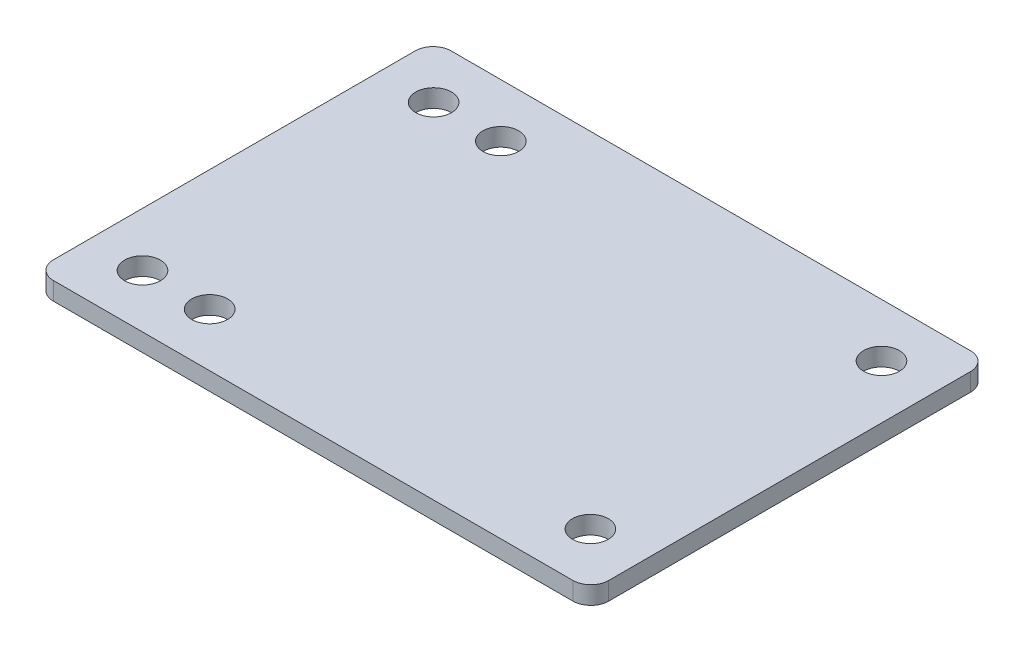
from build123d import *

# Parameters (mm, degrees)
SKETCH1_W           = 78.74
SKETCH1_H           = 56.388
BOSS_EXTRUDE1_DEPTH = 2.54
FILLET1_R           = 2.54
SKETCH2_R           = 2.54
CUT_EXTRUDE1_DEPTH  = 2.54


with BuildPart() as part:
    # Sketch1 → Boss-Extrude1 (new body)
    with BuildSketch(Plane(origin=(0, 0, 0), x_dir=(1, 0, 0), z_dir=(0, 1, 0))):
        Rectangle(SKETCH1_W, SKETCH1_H)
    extrude(amount=BOSS_EXTRUDE1_DEPTH)

    # Fillet1
    fillet1_edges = [part.edges().sort_by_distance(p)[0] for p in [
        (39.37, 1.27, 28.194),
        (-39.37, 1.27, 28.194),
        (-39.37, 1.27, -28.194),
        (39.37, 1.27, -28.194),
    ]]
    fillet(fillet1_edges, radius=FILLET1_R)

    # Sketch2 → Cut-Extrude1 (cut)
    with BuildSketch(Plane(origin=(0, 2.54, 0), x_dir=(1, 0, 0), z_dir=(0, 1, 0))):
        with Locations(Location((31.75, 20.6375, 0), (0, 0, 270))):
            Circle(SKETCH2_R)
        with Locations(Location((31.75, -20.6375, 0), (0, 0, 270))):
            Circle(SKETCH2_R)
        with Locations(Location((-31.75, -20.6375, 0), (0, 0, 270))):
            Circle(SKETCH2_R)
        with Locations(Location((-31.75, 20.6375, 0), (0, 0, 270))):
            Circle(SKETCH2_R)
        with Locations(Location((-22.225, -20.6375, 0), (0, 0, 270))):
            Circle(SKETCH2_R)
        with Locations(Location((-22.225, 20.6375, 0), (0, 0, 270))):
            Circle(SKETCH2_R)
    extrude(amount=-CUT_EXTRUDE1_DEPTH, mode=Mode.SUBTRACT)


solid = part.part
